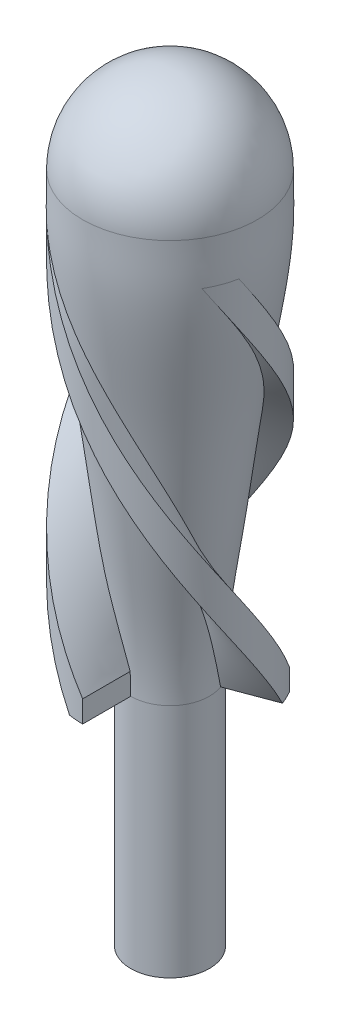
from build123d import *

# Parameters (mm, degrees)
SKETCH2_R           = 4.5
BOSS_EXTRUDE1_DEPTH = 27
SWEEP1_PITCH        = 95
SWEEP1_HEIGHT       = 47.5
SWEEP1_RADIUS       = 10
SKETCH5_W           = 5.5
SKETCH5_H           = 5
CIRPATTERN1_COUNT   = 3
CUT_EXTRUDE2_START  = 2.5
SKETCH7_R           = 10
SKETCH7_R_2         = 4.5
CUT_EXTRUDE2_DEPTH  = 2.5
SKETCH10_R          = 1.5
CUT_EXTRUDE3_DEPTH  = 7.5


with BuildPart() as part:
    # Sketch2 → Boss-Extrude1 (new body)
    with BuildSketch(Plane(origin=(0, 0, 0), x_dir=(1, 0, 0), z_dir=(0, 1, 0))):
        with Locations(Location((0, 0, 0), (0, 0, 270))):
            Circle(SKETCH2_R)
    extrude(amount=-BOSS_EXTRUDE1_DEPTH)

    # Sketch3 → Revolve1 (revolve)
    with BuildSketch(Plane.XY):
        with BuildLine():
            Line((0, 0), (0, 60))
            ThreePointArc((0, 60), (-7.071067812, 57.071067812), (-10, 50))
            add(Edge.make_bspline(
                [(-4.5, 0), (-4.5, 5.137280801), (-6.151663151, 15.017874502), (-7.735769207, 29.854716481), (-10.199411788, 42.071887643), (-10, 48.016040995), (-10, 50)],
                knots=[0, 0, 0, 0, 0.299458125, 0.600067067, 0.90067601, 1, 1, 1, 1], degree=3))
            Line((-4.5, 0), (0, 0))
        make_face()
    revolve(axis=Axis((0, 0, 0), (0, 1, 0)))

    # Sweep1: sweep along a helix
    with BuildLine() as sweep1_path:
        Helix(SWEEP1_PITCH, SWEEP1_HEIGHT, SWEEP1_RADIUS, center=(0, -2.5, 0), direction=(0, 1, 0), lefthand=True)
    with BuildLine() as sweep1_axis:
        Line((0, -2.5, 0), (0, 45, 0))
    # Sketch5 → Sweep1 (sweep)
    with BuildSketch(Plane(origin=(0, 0, 0), x_dir=(0, 0, -1), z_dir=(1, 0, 0))):
        with Locations((-7.25, 0)):
            Rectangle(SKETCH5_W, SKETCH5_H)
    sweep1 = sweep(path=sweep1_path.line, binormal=sweep1_axis.edges()[0])

    # CirPattern1: Sweep1 ×3 about axis
    cirpattern1_axis = Axis((0, -27, 0), (0, 1, 0))
    for i in range(1, CIRPATTERN1_COUNT):
        add(sweep1.rotate(cirpattern1_axis, i * 360 / CIRPATTERN1_COUNT))

    # Sketch7 → Cut-Extrude2 (cut)
    with BuildSketch(Plane(origin=(0, -2.5, 0), x_dir=(1, 0, 0), z_dir=(0, 1, 0)).offset(CUT_EXTRUDE2_START)):
        Circle(SKETCH7_R)
        with Locations(Location((0, 0, 0), (0, 0, 270))):
            Circle(SKETCH7_R_2, mode=Mode.SUBTRACT)
    extrude(amount=-CUT_EXTRUDE2_DEPTH, mode=Mode.SUBTRACT)

    # Sketch10 → Cut-Extrude3 (cut)
    with BuildSketch(Plane.XZ.offset(27)):
        with Locations(Location((0, 0, 0), (0, 0, 270))):
            Circle(SKETCH10_R)
    extrude(amount=-CUT_EXTRUDE3_DEPTH, mode=Mode.SUBTRACT)

    # Sketch11 → Central Pocket (revolve, cut)
    with BuildSketch(Plane.XY):
        with BuildLine():
            Line((0, 55), (0, 27.465144928))
            add(Edge.make_bspline(
                [(0, 27.465144928), (5, 27.465144928), (5, 50)],
                knots=[3.141592654, 3.141592654, 3.141592654, 4.71238898, 4.71238898, 4.71238898], degree=2, weights=[1, 0.707106781, 1]))
            ThreePointArc((5, 50), (3.535533906, 53.535533906), (0, 55))
        make_face()
    revolve(axis=Axis((0, 55, 0), (0, 1, 0)), mode=Mode.SUBTRACT)


solid = part.part
